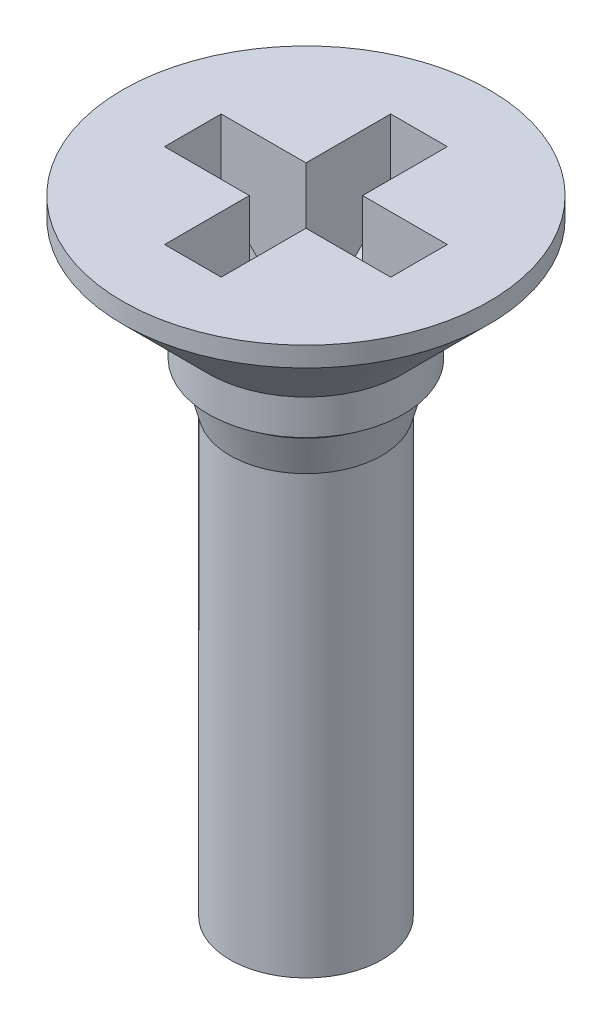
from build123d import *

# Parameters (mm, degrees)
KREUZSCHLITZ1_H_DEPTH      = 0.363
KREUZSCHLITZ1_H_DEPTH_BACK = 0.363
KREUZSCHLITZ2_H_DEPTH      = 0.363
KREUZSCHLITZ2_H_DEPTH_BACK = 0.363


with BuildPart() as part:
    # Skizze1 → Basis-Rotation (revolve)
    with BuildSketch(Plane.XY, mode=Mode.PRIVATE) as basis_rotation_sk:
        Polygon((0, 0), (2.35, 0), (2.35, -0.254), (1.25, -1.354), (1.25, -1.804), (1.104, -1.804), (1.104, -1.914833395), (0.974, -2.4), (0.974, -8), (0, -8), align=None)
    revolve(basis_rotation_sk.sketch.rotate(Axis((0, 0, 0), (0, -1, 0)), 180), axis=Axis((0, 0, 0), (0, -1, 0)))

    # Skizze2 → Kreuzschlitz1 H (cut, two sides: drawn at the far end of the back side and taken through both)
    with BuildSketch(Plane.XY.offset(-KREUZSCHLITZ1_H_DEPTH_BACK)):
        Polygon((-0.55, -1.8), (0.55, -1.8), (1.45, -0.9), (1.45, 0), (-1.45, 0), (-1.45, -0.9), align=None)
    extrude(amount=KREUZSCHLITZ1_H_DEPTH + KREUZSCHLITZ1_H_DEPTH_BACK, mode=Mode.SUBTRACT)

    # Skizze3 → Kreuzschlitz2 H (cut, two sides: drawn at the far end of the back side and taken through both)
    with BuildSketch(Plane(origin=(0, 0, 0), x_dir=(0, 0, -1), z_dir=(1, 0, 0)).offset(-KREUZSCHLITZ2_H_DEPTH_BACK)):
        Polygon((-0.55, -1.8), (0.55, -1.8), (1.45, -0.9), (1.45, 0), (-1.45, 0), (-1.45, -0.9), align=None)
    extrude(amount=KREUZSCHLITZ2_H_DEPTH + KREUZSCHLITZ2_H_DEPTH_BACK, mode=Mode.SUBTRACT)


solid = part.part
